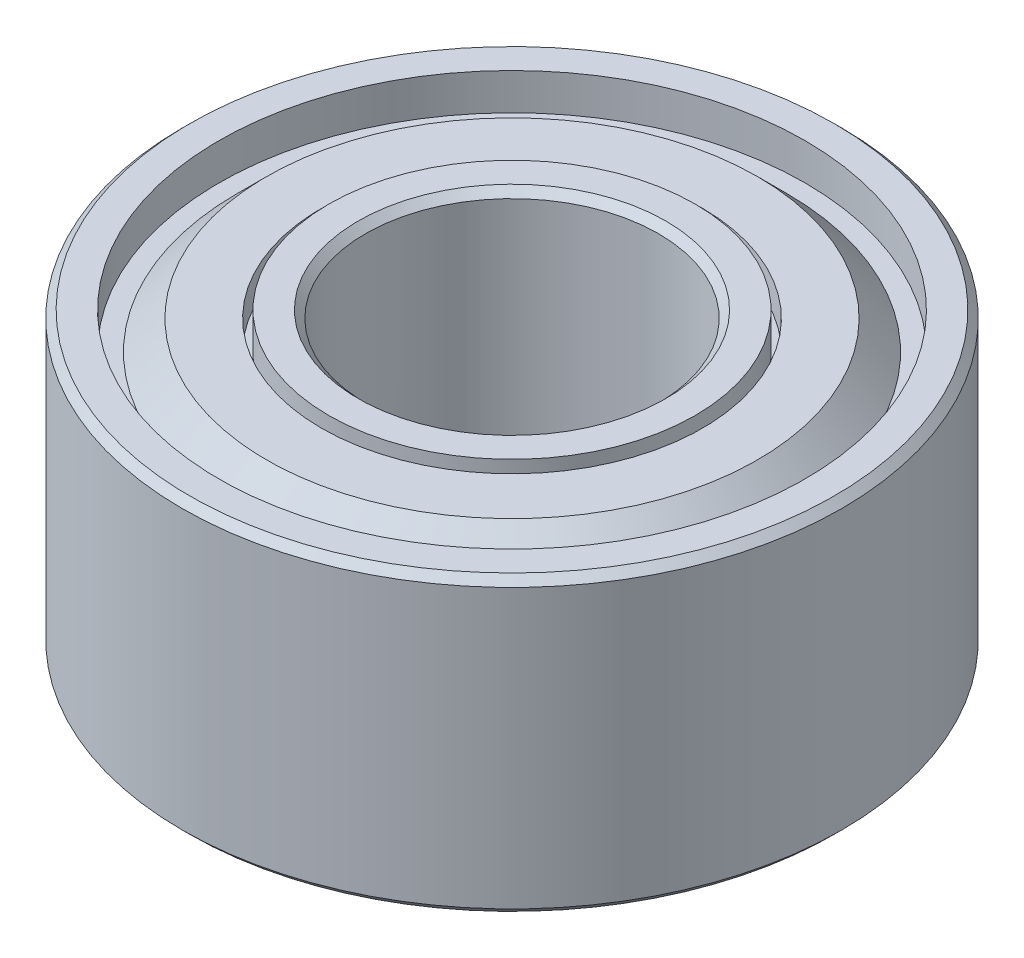
from build123d import *

# Parameters (mm, degrees)
CHAMFER1_SIZE = 0.1


with BuildPart() as part:
    # Sketch1 → Revolve1 (revolve)
    with BuildSketch(Plane(origin=(0, 0, 0), x_dir=(0, 0, -1), z_dir=(1, 0, 0)), mode=Mode.PRIVATE) as revolve1_sk:
        Polygon((-2, 2), (-2, -2), (-2.5, -2), (-2.5, -1.5), (-2.6, -1.5), (-2.6, -1.9), (-3.35, -1.9), (-3.75, -1.5), (-4, -1.5), (-4, -2), (-4.5, -2), (-4.5, 2), (-4, 2), (-4, 1.5), (-3.75, 1.5), (-3.35, 1.9), (-2.6, 1.9), (-2.6, 1.5), (-2.5, 1.5), (-2.5, 2), align=None)
    revolve(revolve1_sk.sketch.rotate(Axis((0, -2, 0), (0, 1, 0)), 180), axis=Axis((0, -2, 0), (0, 1, 0)))

    # Chamfer1
    chamfer1_edges = [part.edges().sort_by_distance(p)[0] for p in [
        (0, 2, 4.5),
        (0, -2, 4.5),
        (0, -2, 2),
        (0, 2, 2),
    ]]
    chamfer(chamfer1_edges, length=CHAMFER1_SIZE)


solid = part.part
